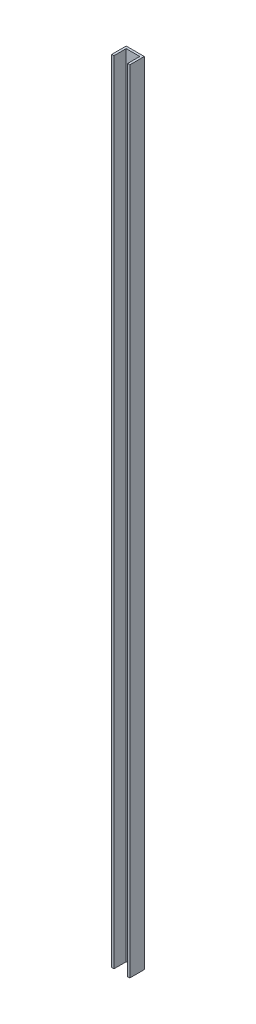
from build123d import *

# Parameters (mm, degrees)
BOSS_EXTRUDE1_DEPTH = 436


with BuildPart() as part:
    # Sketch1 → Boss-Extrude1 (new body)
    with BuildSketch(Plane(origin=(0, 0, 0), x_dir=(1, 0, 0), z_dir=(0, 1, 0))):
        Polygon((3.75, 2.75), (3.75, -4), (5, -4), (5, 4), (-5, 4), (-5, -4), (-3.75, -4), (-3.75, 2.75), align=None)
    extrude(amount=BOSS_EXTRUDE1_DEPTH)


solid = part.part
